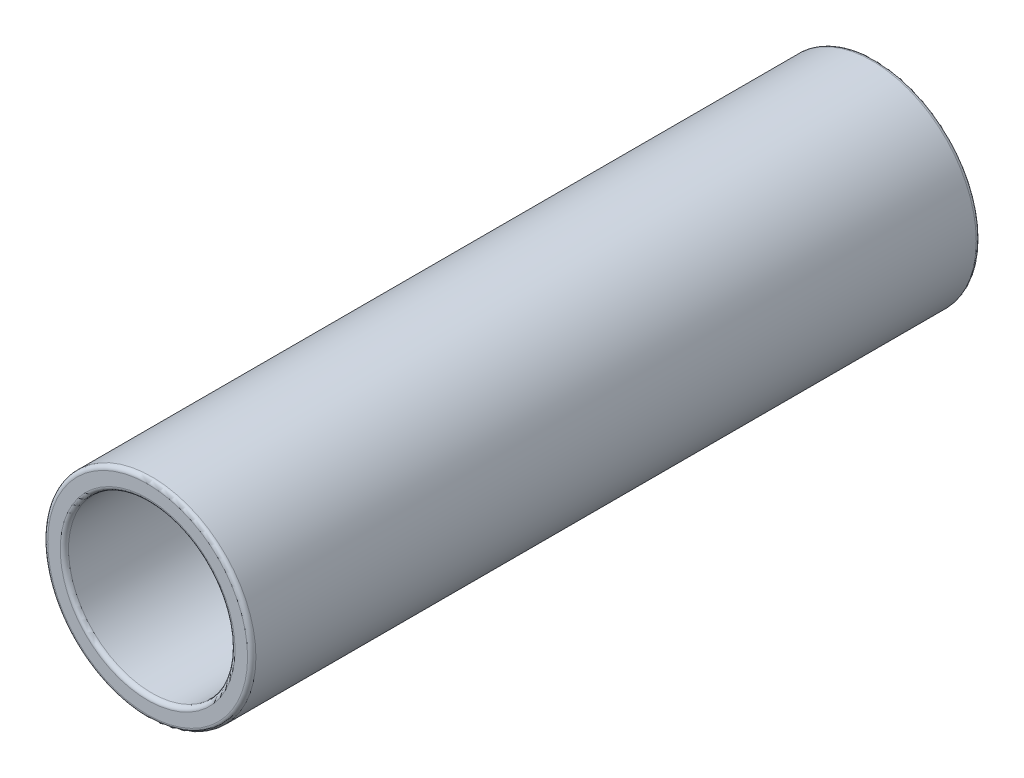
from build123d import *

# Parameters (mm, degrees)
SKIZZE1_R                       = 5
SKIZZE1_R_2                     = 4
AUFSATZ_LINEAR_AUSTRAGEN1_DEPTH = 35
VERRUNDUNG1_R                   = 0.2


with BuildPart() as part:
    # Skizze1 → Aufsatz-Linear austragen1 (new body)
    with BuildSketch(Plane.XY):
        Circle(SKIZZE1_R)
        Circle(SKIZZE1_R_2, mode=Mode.SUBTRACT)
    extrude(amount=AUFSATZ_LINEAR_AUSTRAGEN1_DEPTH)

    # Verrundung1
    verrundung1_edges = [part.edges().sort_by_distance(p)[0] for p in [
        (-5, 0, 0),
        (-5, 0, 35),
        (-4, 0, 0),
        (-4, 0, 35),
    ]]
    fillet(verrundung1_edges, radius=VERRUNDUNG1_R)


solid = part.part
